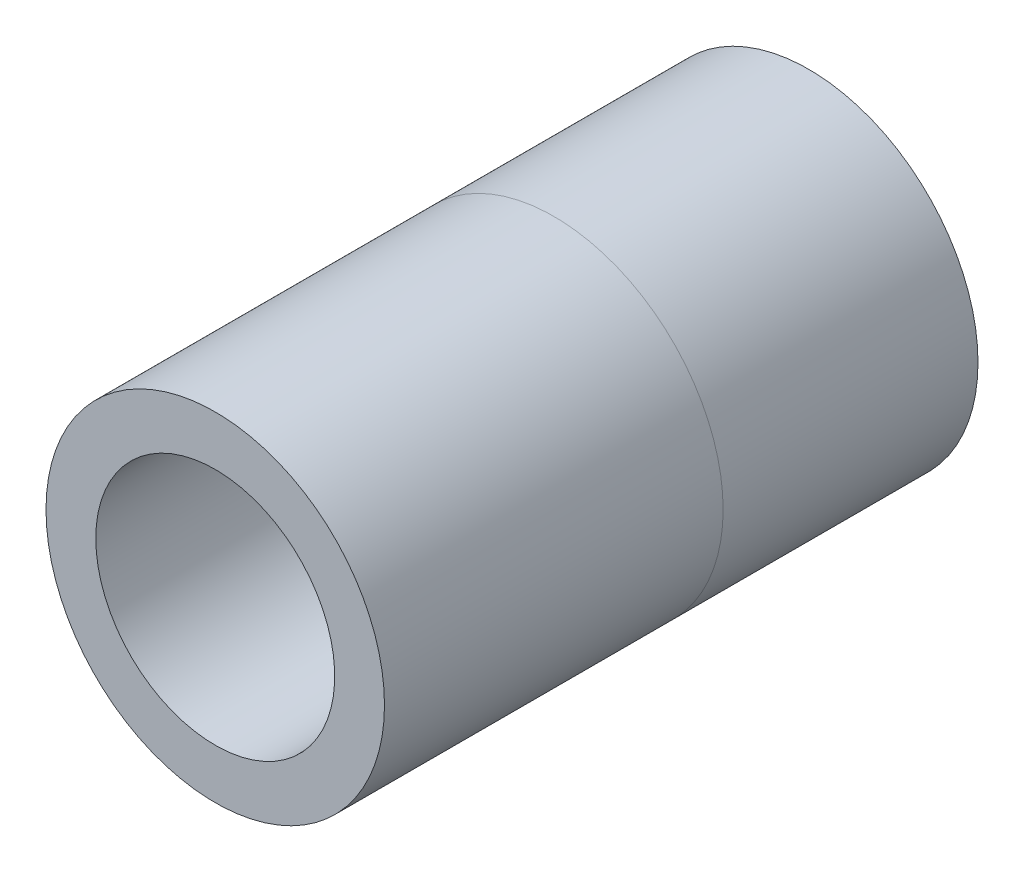
from build123d import *

# Parameters (mm, degrees)
SWEEP1_PROFILE_R     = 13.49375
CUT_SWEEP1_PROFILE_R = 9.525


with BuildPart() as part:
    # Sweep1: sweep along a curve in space
    with BuildLine() as sweep1_path:
        Line((-90.137600423, 20.542096307, 0), (-90.137600423, 20.542096307, -20.32))
        Line((-90.137600423, 20.542096307, 0), (-90.137600423, 20.542096307, 27.000000342))
    # Sweep1 profile (on start of the path) → Sweep1 (sweep)
    with BuildSketch(Plane(origin=(-90.137600423, 20.542096307, 27.000000342), x_dir=(-1.0, 0, 2.9384889211061883e-12), z_dir=(-2.9384889211061883e-12, 2.864276680755844e-12, -1.0))):
        Circle(SWEEP1_PROFILE_R)
    sweep(path=sweep1_path.line)

    # Cut-Sweep1: sweep along a curve in space
    with BuildLine() as cut_sweep1_path:
        Line((-90.137600423, 20.542096307, 0), (-90.137600423, 20.542096307, -20.32))
        Line((-90.137600423, 20.542096307, 0), (-90.137600423, 20.542096307, 27.000000342))
    # Cut-Sweep1 profile (on start of the path) → Cut-Sweep1 (sweep, cut)
    with BuildSketch(Plane(origin=(-90.137600423, 20.542096307, 27.000000342), x_dir=(-1.0, 0, 2.9384889211061883e-12), z_dir=(-2.9384889211061883e-12, 2.864276680755844e-12, -1.0))):
        Circle(CUT_SWEEP1_PROFILE_R)
    sweep(path=cut_sweep1_path.line, mode=Mode.SUBTRACT)


solid = part.part
